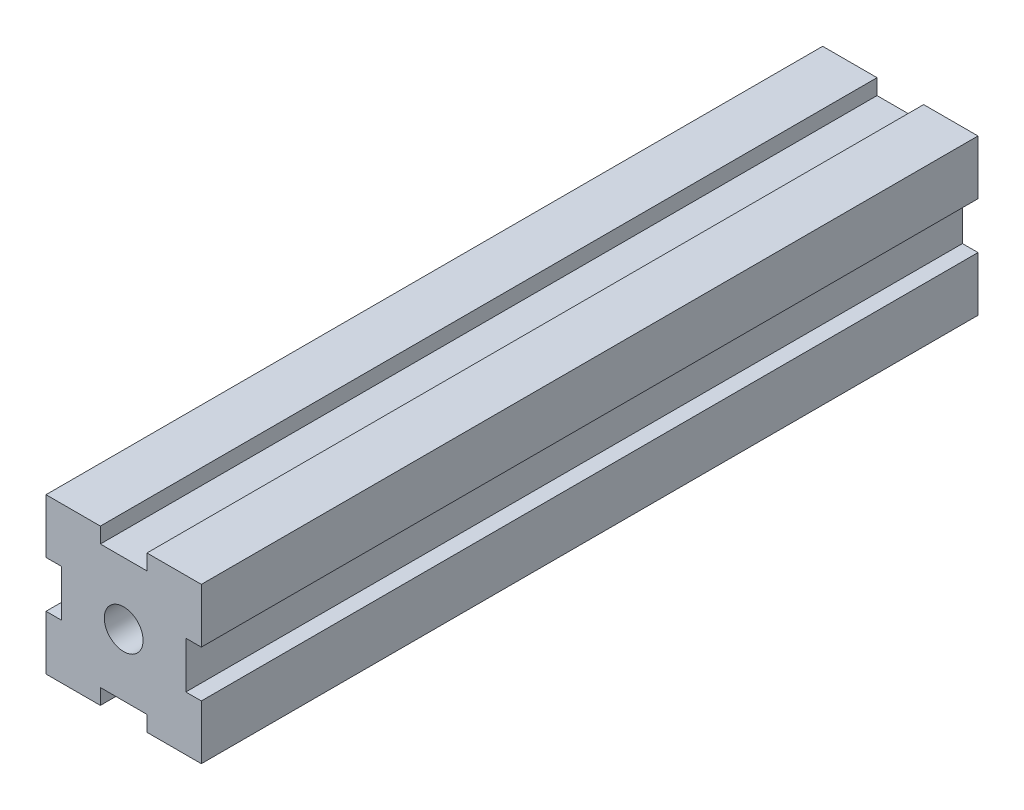
from build123d import *

# Parameters (mm, degrees)
SKETCH_1_R      = 2.5
EXTRUDE_1_DEPTH = 100


with BuildPart() as part:
    # 草图1 → 凸台-拉伸1 (new body)
    with BuildSketch(Plane.XY):
        Polygon((0, -13), (0, -20), (7, -20), (7, -18), (13, -18), (13, -20), (20, -20), (20, -13), (18, -13), (18, -7), (20, -7), (20, 0), (13, 0), (13, -2), (7, -2), (7, 0), (0, 0), (0, -7), (2, -7), (2, -13), align=None)
        with Locations((10, -10)):
            Circle(SKETCH_1_R, mode=Mode.SUBTRACT)
    extrude(amount=EXTRUDE_1_DEPTH)


solid = part.part
